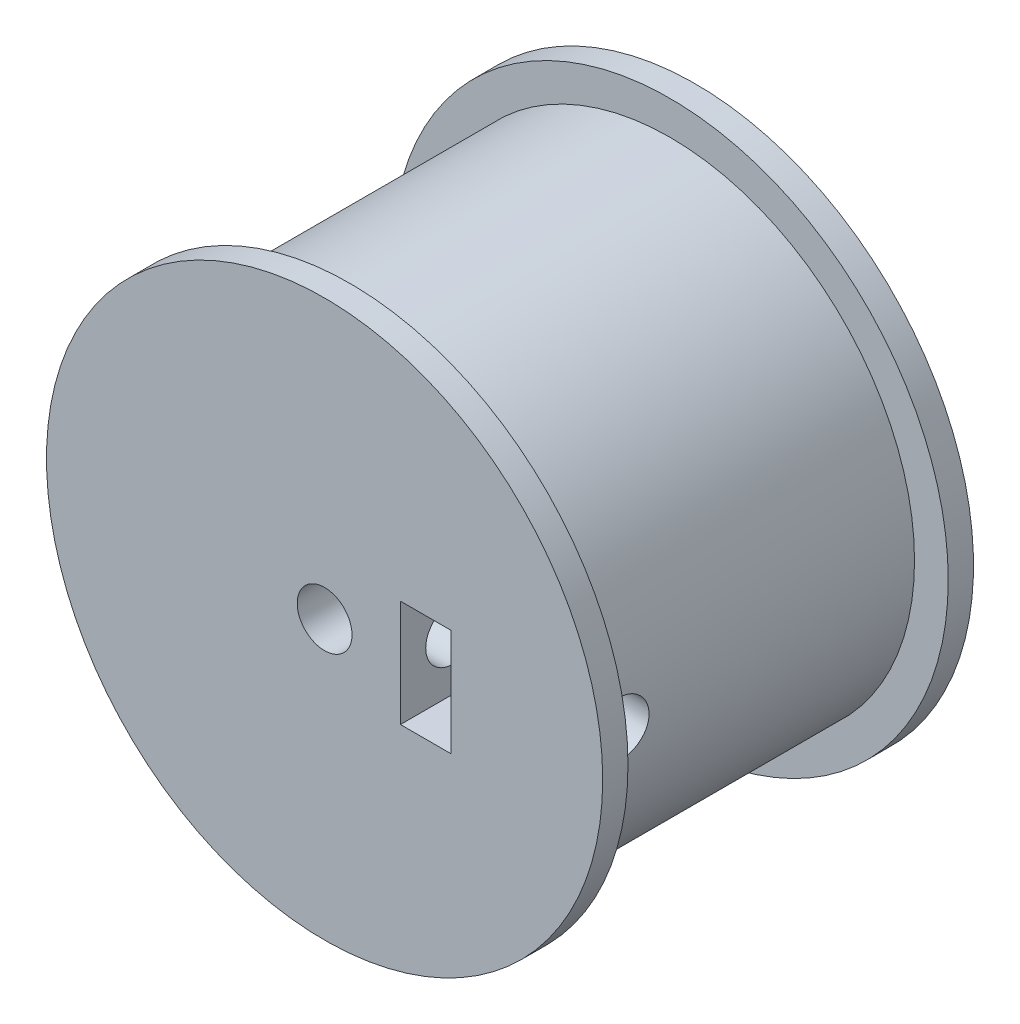
from build123d import *

# Parameters (mm, degrees)
CROQUIS1_R                 = 15.5
CROQUIS1_R_2               = 1.5
SALIENTE_EXTRUIR1_DEPTH    = 18.25
CROQUIS2_R                 = 9
CORTAR_EXTRUIR1_DEPTH      = 10
CROQUIS3_R                 = 16.5
CROQUIS3_R_2               = 15.5
SALIENTE_EXTRUIR2_DEPTH    = 1.5
SALIENTE_EXTRUIR3_START    = -1.5
CROQUIS4_R                 = 16.5
CROQUIS4_R_2               = 15.5
SALIENTE_EXTRUIR3_DEPTH    = 1.5
CROQUIS5_W                 = 3
CROQUIS5_H                 = 6.34
CORTAR_EXTRUIR2_DEPTH      = 6.25
CORTAR_EXTRUIR3_DEPTH      = 8
CORTAR_EXTRUIR3_DEPTH_BACK = 9.75
CROQUIS7_R                 = 1.625
CROQUIS8_R                 = 1.625
CORTAR_EXTRUIR4_DEPTH      = 8.25
CORTAR_EXTRUIR7_START      = 15.25
CROQUIS9_R                 = 15.5
CROQUIS9_R_2               = 14.5
CORTAR_EXTRUIR7_DEPTH      = 15.25
CROQUIS11_R                = 16.5
CROQUIS11_R_2              = 9
SALIENTE_EXTRUIR4_DEPTH    = 3.75
CROQUIS12_R                = 16.5
CROQUIS12_R_2              = 14.5
CORTAR_EXTRUIR8_DEPTH      = 3.75


with BuildPart() as part:
    # Croquis1 → Saliente-Extruir1 (new body)
    with BuildSketch(Plane.XY):
        with Locations((-6.34746922, -2.918376653)):
            Circle(CROQUIS1_R)
        with Locations((-6.34746922, -2.918376653)):
            Circle(CROQUIS1_R_2, mode=Mode.SUBTRACT)
    extrude(amount=-SALIENTE_EXTRUIR1_DEPTH)

    # Croquis2 → Cortar-Extruir1 (cut)
    with BuildSketch(Plane(origin=(0, 0, -18.25), x_dir=(-1, 0, 0), z_dir=(0, 0, -1))):
        with Locations((6.34746922, -2.918376653)):
            Circle(CROQUIS2_R)
    extrude(amount=-CORTAR_EXTRUIR1_DEPTH, mode=Mode.SUBTRACT)

    # Croquis3 → Saliente-Extruir2 (add)
    with BuildSketch(Plane.XY):
        with Locations((-6.34746922, -2.918376653)):
            Circle(CROQUIS3_R)
        with Locations((-6.34746922, -2.918376653)):
            Circle(CROQUIS3_R_2, mode=Mode.SUBTRACT)
    extrude(amount=-SALIENTE_EXTRUIR2_DEPTH)

    # Croquis4 → Saliente-Extruir3 (add)
    with BuildSketch(Plane(origin=(0, 0, -18.25), x_dir=(-1, 0, 0), z_dir=(0, 0, -1)).offset(SALIENTE_EXTRUIR3_START)):
        with Locations(Location((6.34746922, -2.918376653, 0), (0, 0, 180))):
            Circle(CROQUIS4_R)
        with Locations(Location((6.34746922, -2.918376653, 0), (0, 0, 180))):
            Circle(CROQUIS4_R_2, mode=Mode.SUBTRACT)
    extrude(amount=SALIENTE_EXTRUIR3_DEPTH)

    # Croquis5 → Cortar-Extruir2 (cut)
    with BuildSketch(Plane.XY):
        with Locations((-0.34746922, -2.918376653)):
            Rectangle(CROQUIS5_W, CROQUIS5_H)
    extrude(amount=-CORTAR_EXTRUIR2_DEPTH, mode=Mode.SUBTRACT)

    # Croquis7 → Cortar-Extruir3 (cut, two sides: drawn at the far end of the back side and taken through both)
    with BuildSketch(Plane.ZY.offset(-1.15253078).offset(-CORTAR_EXTRUIR3_DEPTH_BACK)):
        with Locations((-3.125, -2.918376653)):
            Circle(CROQUIS7_R)
    extrude(amount=CORTAR_EXTRUIR3_DEPTH + CORTAR_EXTRUIR3_DEPTH_BACK, mode=Mode.SUBTRACT)

    # Croquis8 → Cortar-Extruir4 (cut)
    with BuildSketch(Plane.XY):
        with Locations((-6.34746922, -2.918376653)):
            Circle(CROQUIS8_R)
    extrude(amount=-CORTAR_EXTRUIR4_DEPTH, mode=Mode.SUBTRACT)

    # Croquis9 → Cortar-Extruir7 (cut)
    with BuildSketch(Plane.XY.offset(-16.75).offset(CORTAR_EXTRUIR7_START)):
        with Locations((-6.34746922, -2.918376653)):
            Circle(CROQUIS9_R)
        with Locations((-6.34746922, -2.918376653)):
            Circle(CROQUIS9_R_2, mode=Mode.SUBTRACT)
    extrude(amount=-CORTAR_EXTRUIR7_DEPTH, mode=Mode.SUBTRACT)

    # Croquis11 → Saliente-Extruir4 (add)
    with BuildSketch(Plane(origin=(0, 0, -18.25), x_dir=(-1, 0, 0), z_dir=(0, 0, -1))):
        with Locations(Location((6.34746922, -2.918376653, 0), (0, 0, 180))):
            Circle(CROQUIS11_R)
        with Locations((6.34746922, -2.918376653)):
            Circle(CROQUIS11_R_2, mode=Mode.SUBTRACT)
    extrude(amount=SALIENTE_EXTRUIR4_DEPTH)

    # Croquis12 → Cortar-Extruir8 (cut)
    with BuildSketch(Plane.XY.offset(-16.75)):
        with Locations(Location((-6.34746922, -2.918376653, 0), (0, 0, 180))):
            Circle(CROQUIS12_R)
        with Locations((-6.34746922, -2.918376653)):
            Circle(CROQUIS12_R_2, mode=Mode.SUBTRACT)
    extrude(amount=-CORTAR_EXTRUIR8_DEPTH, mode=Mode.SUBTRACT)


solid = part.part
